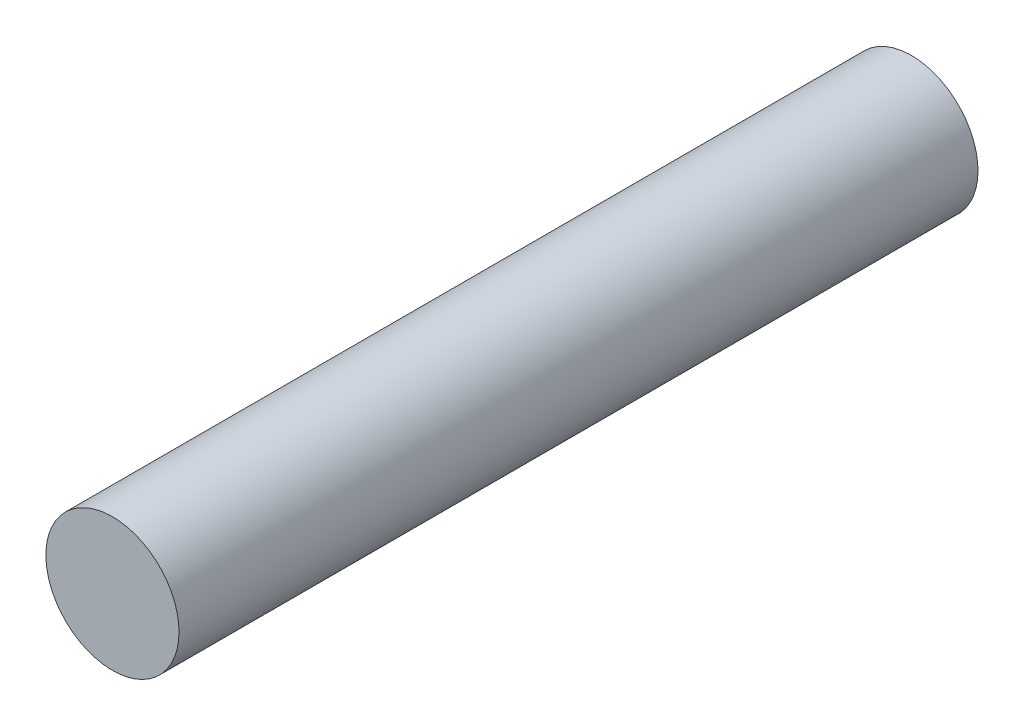
from build123d import *

# Parameters (mm, degrees)
SKETCH_1_R      = 1
EXTRUDE_1_DEPTH = 12


with BuildPart() as part:
    # 草图1 → 凸台-拉伸1 (new body)
    with BuildSketch(Plane.XY):
        Circle(SKETCH_1_R)
    extrude(amount=EXTRUDE_1_DEPTH)


solid = part.part
